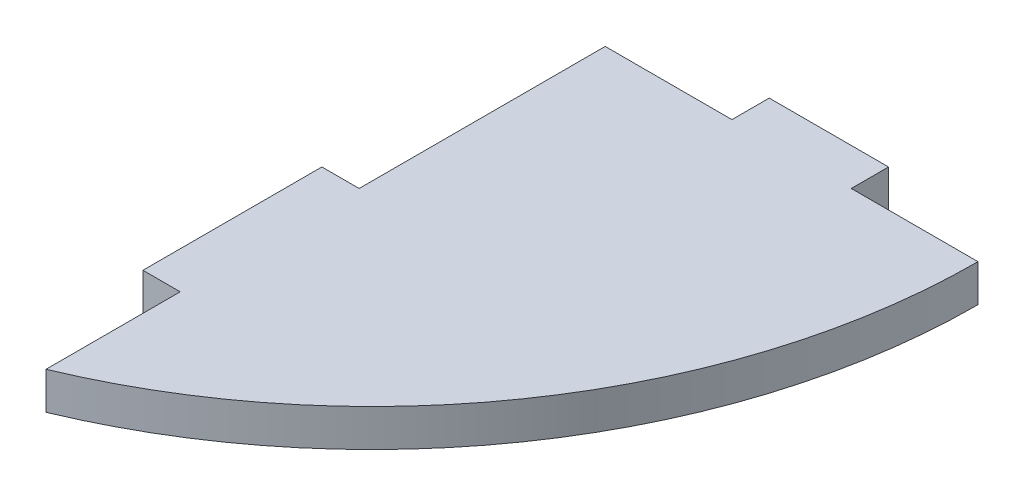
from build123d import *

# Parameters (mm, degrees)
BOSS_EXTRUDE1_DEPTH = 3.175


with BuildPart() as part:
    # Sketch1 → Boss-Extrude1 (new body)
    with BuildSketch(Plane(origin=(0, 0, 0), x_dir=(1, 0, 0), z_dir=(0, 1, 0))):
        with BuildLine():
            Line((0, 26.67), (3.175, 26.67))
            Line((3.175, 26.67), (3.175, 47.625))
            Line((3.175, 47.625), (13.97, 47.625))
            Line((13.97, 47.625), (13.97, 50.8))
            Line((13.97, 50.8), (24.13, 50.8))
            Line((24.13, 50.8), (24.13, 47.625))
            Line((24.13, 47.625), (34.925, 47.625))
            ThreePointArc((34.925, 47.625), (26.259844873, 19.005936751), (3.175, 0))
            Line((3.175, 0), (3.175, 11.43))
            Line((3.175, 11.43), (0, 11.43))
            Line((0, 11.43), (0, 26.67))
        make_face()
    extrude(amount=BOSS_EXTRUDE1_DEPTH)


solid = part.part
